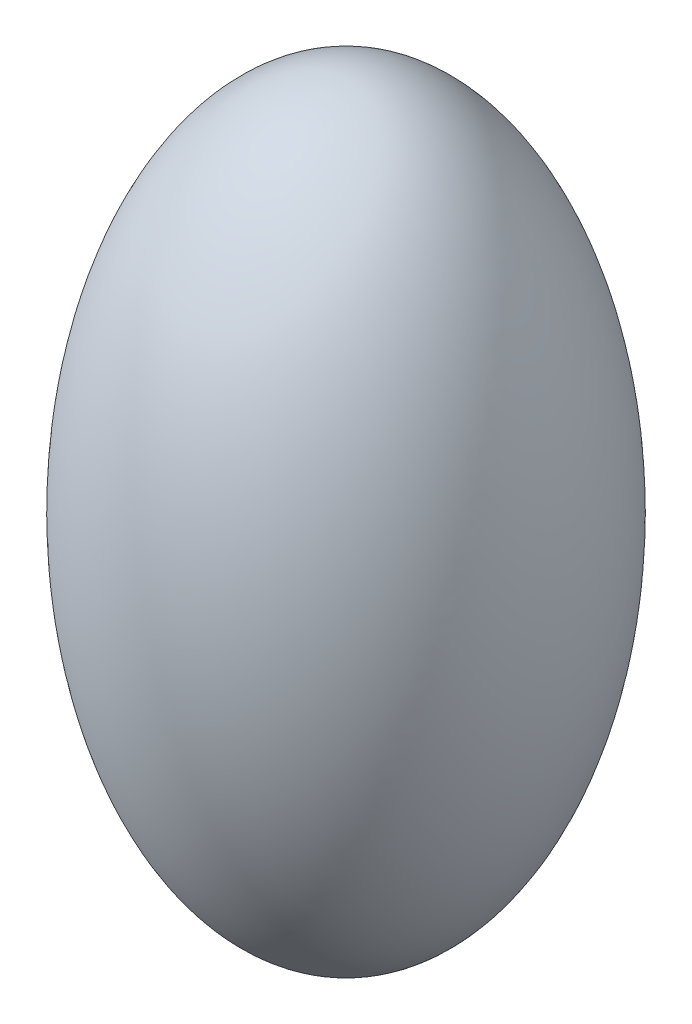
from build123d import *


with BuildPart() as part:
    # Esboço1 → Revolução1 (revolve)
    with BuildSketch(Plane(origin=(0, 0, 0), x_dir=(0, 0, -1), z_dir=(1, 0, 0))):
        with BuildLine():
            Line((0, 30.171370586), (0, -30.171370586))
            add(Edge.make_bspline(
                [(0, -30.171370586), (17.034553728, -30.171370586), (17.034553728, 0), (17.034553728, 30.171370586), (0, 30.171370586)],
                knots=[3.141592654, 3.141592654, 3.141592654, 4.71238898, 4.71238898, 6.283185307, 6.283185307, 6.283185307], degree=2, weights=[1, 0.707106781, 1, 0.707106781, 1]))
        make_face()
    revolve(axis=Axis((0, 30.171370586, 0), (0, -1, 0)))


solid = part.part
